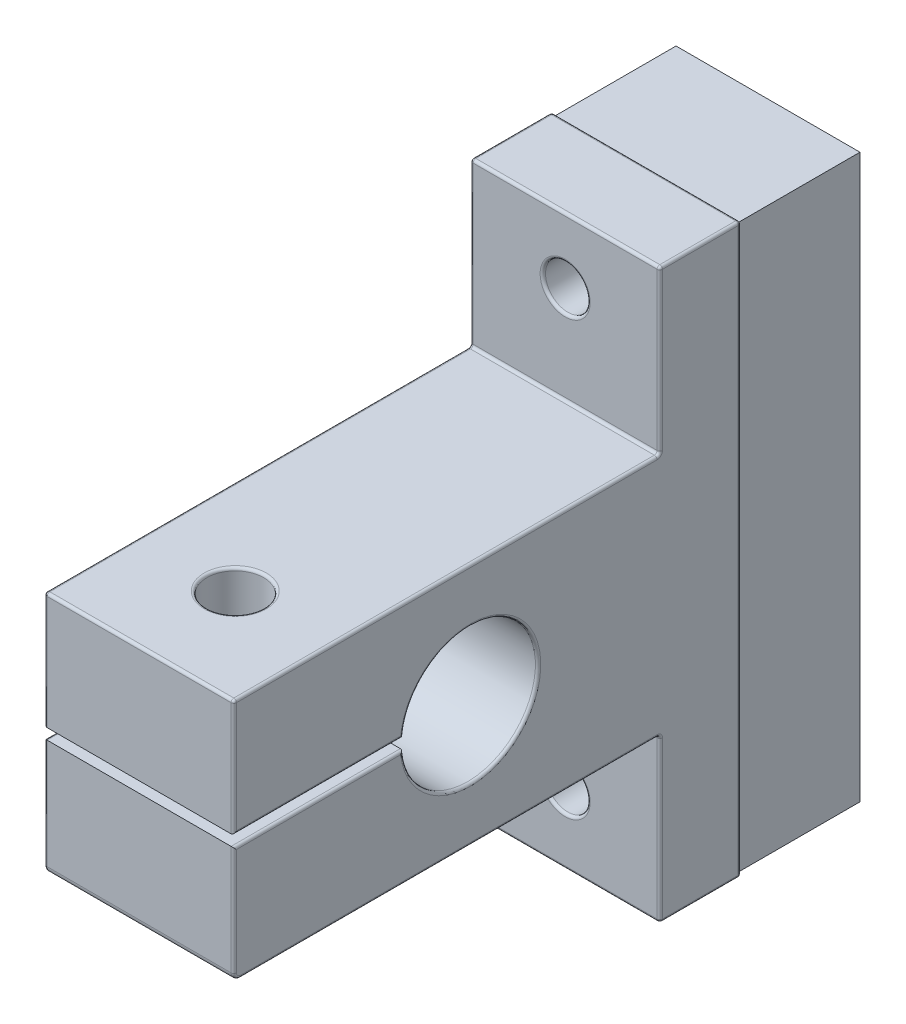
from build123d import *

# Parameters (mm, degrees)
SKETCH1_W                      = 37.5
SKETCH1_H                      = 42
BOSS_EXTRUDE1_DEPTH            = 14
SKETCH2_W                      = 31.5
SKETCH2_H                      = 12
CUT_EXTRUDE1_DEPTH             = 81.340693322
SKETCH3_W                      = 31.5
SKETCH3_H                      = 12
CUT_EXTRUDE2_DEPTH             = 81.340693322
CUT_EXTRUDE3_DEPTH             = 81.340693322
SKETCH5_W                      = 14
SKETCH5_H                      = 5
SKETCH6_W                      = 2.1
SKETCH6_H                      = 20.6
F_3_3_3_3_DIAMETER_HOLE1_D     = 3.3
F_3_3_3_3_DIAMETER_HOLE1_DEPTH = 37.5
F_3_3_3_3_DIAMETER_HOLE2_D     = 3.3
FILLET1_R                      = 0.5
FILLET2_R                      = 0.2
SKETCH12_W                     = 13.6
SKETCH12_H                     = 41.6
SKETCH12_R                     = 1.65
BOSS_EXTRUDE2_DEPTH            = 9


with BuildPart() as part:
    # Sketch1 → Boss-Extrude1 (new body)
    with BuildSketch(Plane(origin=(7, 0, 0), x_dir=(0, 0, -1), z_dir=(1, 0, 0))):
        with Locations((28.843301609, 42.194182053)):
            Rectangle(SKETCH1_W, SKETCH1_H)
    extrude(amount=-BOSS_EXTRUDE1_DEPTH)

    # Sketch2 → Cut-Extrude1 (cut, through all)
    with BuildSketch(Plane.ZY.offset(7)):
        with Locations((-25.843301609, 27.194182053)):
            Rectangle(SKETCH2_W, SKETCH2_H)
    extrude(amount=-CUT_EXTRUDE1_DEPTH, mode=Mode.SUBTRACT)

    # Sketch3 → Cut-Extrude2 (cut, through all)
    with BuildSketch(Plane.ZY.offset(7)):
        with Locations((-25.843301609, 57.194182053)):
            Rectangle(SKETCH3_W, SKETCH3_H)
    extrude(amount=-CUT_EXTRUDE2_DEPTH, mode=Mode.SUBTRACT)

    # Sketch4 → Cut-Extrude3 (cut, through all)
    with BuildSketch(Plane.ZY.offset(7)):
        with BuildLine():
            Line((-10.093301609, 41.794182053), (-10.093301609, 42.594182053))
            Line((-10.093301609, 42.594182053), (-22.609327291, 42.594182053))
            ThreePointArc((-22.609327291, 42.594182053), (-22.593301609, 42.194182053), (-22.609327291, 41.794182053))
            Line((-22.609327291, 41.794182053), (-10.093301609, 41.794182053))
        make_face()
    extrude(amount=-CUT_EXTRUDE3_DEPTH, mode=Mode.SUBTRACT)

    # Sketch5 → Cut-Revolve1 (revolve, cut)
    with BuildSketch(Plane.XY.offset(-27.593301609)):
        with Locations((0, 44.694182053)):
            Rectangle(SKETCH5_W, SKETCH5_H)
    revolve(axis=Axis((-7, 42.194182053, -27.593301609), (1, 0, 0)), mode=Mode.SUBTRACT)

    # Sketch6 → Ø4.2 (4.2) Diameter Hole1 (revolve, cut)
    with BuildSketch(Plane(origin=(0, 42.594182053, -17.202861607), x_dir=(0, 0, -1), z_dir=(1, 0, 0))):
        with Locations((1.05, 10.3)):
            Rectangle(SKETCH6_W, SKETCH6_H)
    revolve(axis=Axis((0, 36.244182053, -17.202861607), (0, 1, 0)), mode=Mode.SUBTRACT)

    # Ø3.3 (3.3) Diameter Hole1
    with Locations(Plane(origin=(0, 0, -47.593301609), x_dir=(-1, 0, 0), z_dir=(0, 0, -1))):
        with Locations((0, 26.394182053)):
            Hole(F_3_3_3_3_DIAMETER_HOLE1_D / 2, depth=F_3_3_3_3_DIAMETER_HOLE1_DEPTH)

    # Ø3.3 (3.3) Diameter Hole2 (through all)
    with Locations(Plane.XY.offset(-41.593301609)):
        with Locations((0, 58.394182053)):
            Hole(F_3_3_3_3_DIAMETER_HOLE2_D / 2)

    # Fillet1
    fillet1_edges = [part.edges().sort_by_distance(p)[0] for p in [
        (0, 33.194182053, -10.093301609),
    ]]
    fillet(fillet1_edges, radius=FILLET1_R)

    # Fillet2
    fillet2_edges = [part.edges().sort_by_distance(p)[0] for p in [
        (7, 21.194182053, -44.593301609),
        (-7, 21.194182053, -44.593301609),
        (7, 27.194182053, -41.593301609),
        (0, 21.194182053, -41.593301609),
        (0, 33.194182053, -41.593301609),
        (-7, 27.194182053, -41.593301609),
        (7, 46.894182053, -10.093301609),
        (-7, 46.894182053, -10.093301609),
        (7, 51.194182053, -25.843301609),
        (0, 51.194182053, -10.093301609),
        (7, 57.194182053, -41.593301609),
        (0, 51.194182053, -41.593301609),
        (0, 63.194182053, -41.593301609),
        (-7, 57.194182053, -41.593301609),
        (-7, 51.194182053, -25.843301609),
        (-7, 42.194182053, -47.593301609),
        (7, 37.744182053, -10.093301609),
        (-7, 37.744182053, -10.093301609),
        (7, 41.794182053, -16.35131445),
        (7, 42.594182053, -16.35131445),
        (-7, 41.794182053, -16.35131445),
        (-7, 42.594182053, -16.35131445),
        (7, 63.194182053, -44.593301609),
        (7, 42.194182053, -47.593301609),
        (-7, 42.194182053, -32.593301609),
        (7, 42.194182053, -32.593301609),
        (0, 51.194182053, -15.102861607),
        (0, 42.594182053, -15.102861607),
        (-7, 63.194182053, -44.593301609),
        (-1.65, 26.394182053, -41.593301609),
        (-1.65, 26.394182053, -47.593301609),
        (0, 21.194182053, -47.593301609),
        (0, 63.194182053, -47.593301609),
        (1.65, 58.394182053, -41.593301609),
        (1.65, 58.394182053, -47.593301609),
        (-7, 33.194182053, -26.093301609),
        (7, 33.194182053, -26.093301609),
        (-7, 33.340628663, -10.239748219),
        (7, 33.340628663, -10.239748219),
    ]]
    fillet(fillet2_edges, radius=FILLET2_R)

    # Sketch12 → Boss-Extrude2 (add)
    with BuildSketch(Plane(origin=(0, 0, -47.593301609), x_dir=(-1, 0, 0), z_dir=(0, 0, -1))):
        with Locations((0, 42.194182053)):
            Rectangle(SKETCH12_W, SKETCH12_H)
        with Locations(Location((0, 26.394182053, 0), (0, 0, 90))):
            Circle(SKETCH12_R, mode=Mode.SUBTRACT)
        with Locations(Location((0, 58.394182053, 0), (0, 0, 90))):
            Circle(SKETCH12_R, mode=Mode.SUBTRACT)
    extrude(amount=BOSS_EXTRUDE2_DEPTH)


solid = part.part
